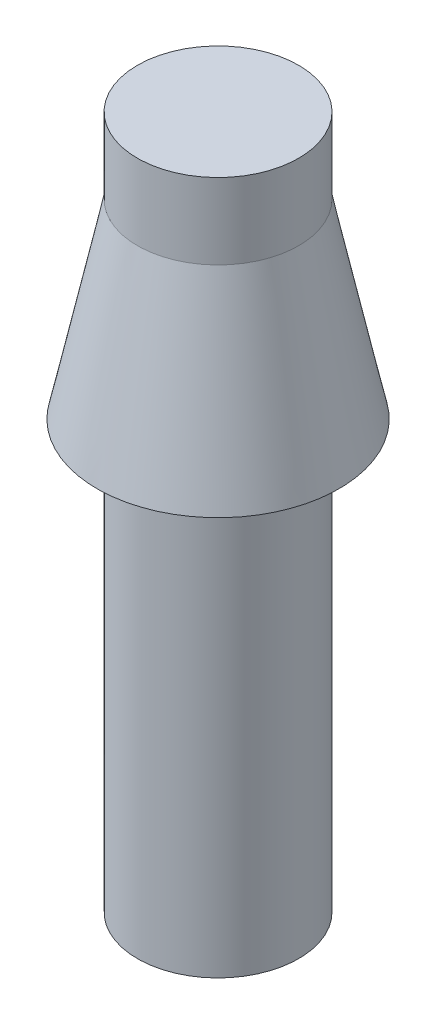
from build123d import *

# Parameters (mm, degrees)
SKETCH2_W = 5
SKETCH2_H = 4.7


with BuildPart() as part:
    # Sketch2 → Revolve1 (revolve)
    with BuildSketch(Plane.XY, mode=Mode.PRIVATE) as revolve1_sk:
        Polygon((0, 38.3), (0, 0), (5, 0), (5, 26.5), (7.508167428, 26.5), (5, 38.3), align=None)
        with Locations((2.5, 40.65)):
            Rectangle(SKETCH2_W, SKETCH2_H)
    revolve(revolve1_sk.sketch.rotate(Axis((0, 43, 0), (0, -1, 0)), 180), axis=Axis((0, 43, 0), (0, -1, 0)))


solid = part.part
